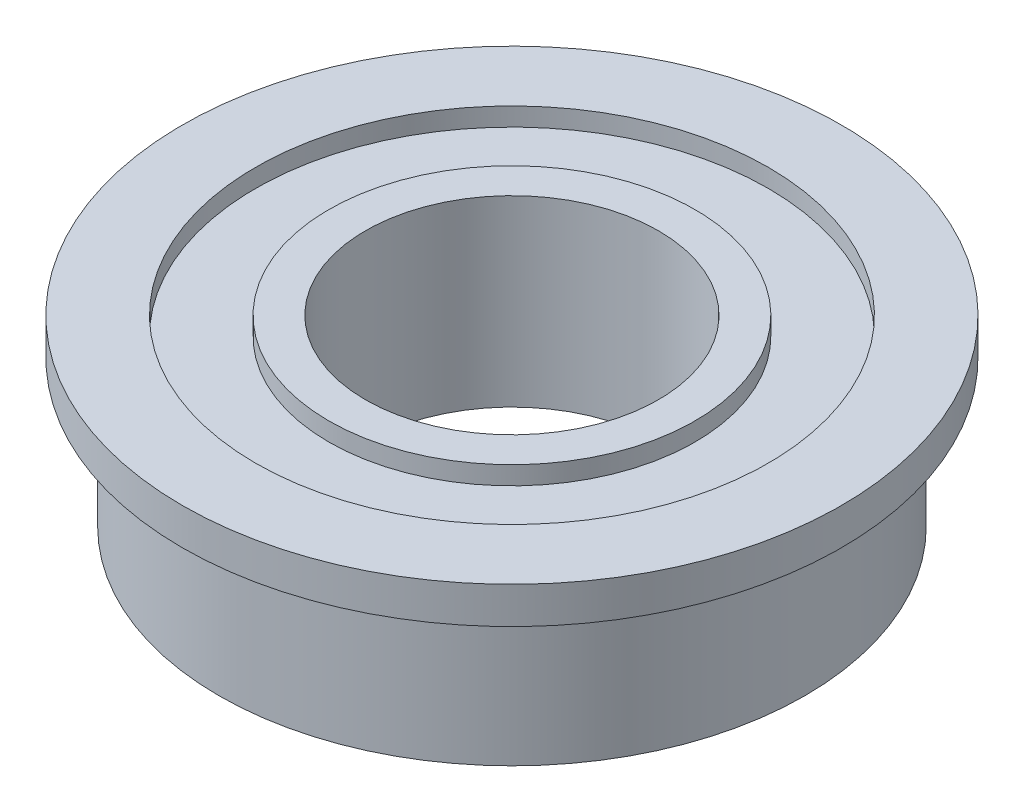
from build123d import *

# Parameters (mm, degrees)
SKETCH1_R           = 8
SKETCH1_R_2         = 4
BOSS_EXTRUDE1_DEPTH = 4
SKETCH2_R           = 9
SKETCH2_R_2         = 4
BOSS_EXTRUDE2_DEPTH = 1
SKETCH3_R           = 7
SKETCH3_R_2         = 5
CUT_EXTRUDE1_DEPTH  = 0.5
CUT_EXTRUDE2_START  = -0.5
SKETCH4_R           = 7
SKETCH4_R_2         = 5
CUT_EXTRUDE2_DEPTH  = 0.5


with BuildPart() as part:
    # Sketch1 → Boss-Extrude1 (new body)
    with BuildSketch(Plane(origin=(0, 0, 0), x_dir=(1, 0, 0), z_dir=(0, 1, 0))):
        with Locations(Location((0, 0, 0), (0, 0, 270))):
            Circle(SKETCH1_R)
        with Locations(Location((0, 0, 0), (0, 0, 270))):
            Circle(SKETCH1_R_2, mode=Mode.SUBTRACT)
    extrude(amount=BOSS_EXTRUDE1_DEPTH)

    # Sketch2 → Boss-Extrude2 (add)
    with BuildSketch(Plane(origin=(0, 4, 0), x_dir=(1, 0, 0), z_dir=(0, 1, 0))):
        with Locations(Location((0, 0, 0), (0, 0, 270))):
            Circle(SKETCH2_R)
        with Locations(Location((0, 0, 0), (0, 0, 270))):
            Circle(SKETCH2_R_2, mode=Mode.SUBTRACT)
    extrude(amount=BOSS_EXTRUDE2_DEPTH)

    # Sketch3 → Cut-Extrude1 (cut)
    with BuildSketch(Plane.XZ):
        with Locations(Location((0, 0, 0), (0, 0, 270))):
            Circle(SKETCH3_R)
        with Locations(Location((0, 0, 0), (0, 0, 270))):
            Circle(SKETCH3_R_2, mode=Mode.SUBTRACT)
    extrude(amount=-CUT_EXTRUDE1_DEPTH, mode=Mode.SUBTRACT)

    # Sketch4 → Cut-Extrude2 (cut)
    with BuildSketch(Plane(origin=(0, 5, 0), x_dir=(1, 0, 0), z_dir=(0, 1, 0)).offset(CUT_EXTRUDE2_START)):
        with Locations(Location((0, 0, 0), (0, 0, 90))):
            Circle(SKETCH4_R)
        with Locations(Location((0, 0, 0), (0, 0, 90))):
            Circle(SKETCH4_R_2, mode=Mode.SUBTRACT)
    extrude(amount=CUT_EXTRUDE2_DEPTH, mode=Mode.SUBTRACT)


solid = part.part
